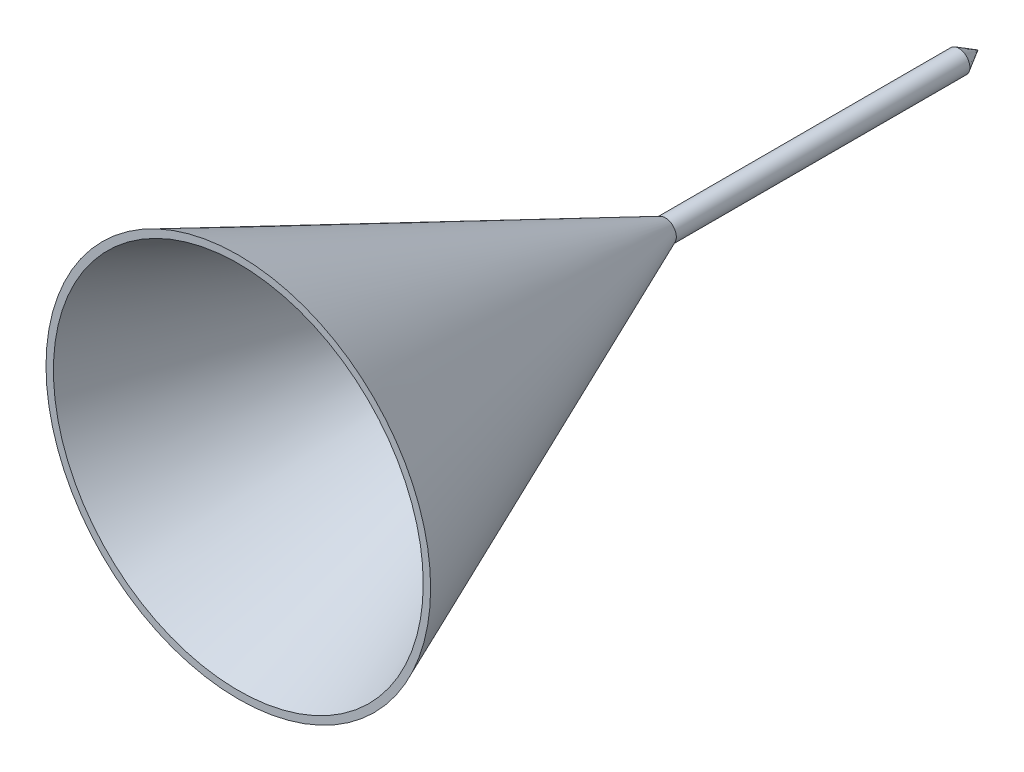
from build123d import *


with BuildPart() as part:
    # Sketch2 → Revolve1 (revolve)
    with BuildSketch(Plane(origin=(0, 0, 0), x_dir=(1, 0, 0), z_dir=(0, 1, 0))):
        Polygon((3810, 0), (3962.4, 0), (228.6, 8796.281563513), (228.6, 14844.05318539), (0, 15240), (0, 15011.4), (76.2, 14879.417728463), (76.2, 8796.281563513), align=None)
    revolve(axis=Axis((0, 0, 0), (0, 0, -1)))


solid = part.part
